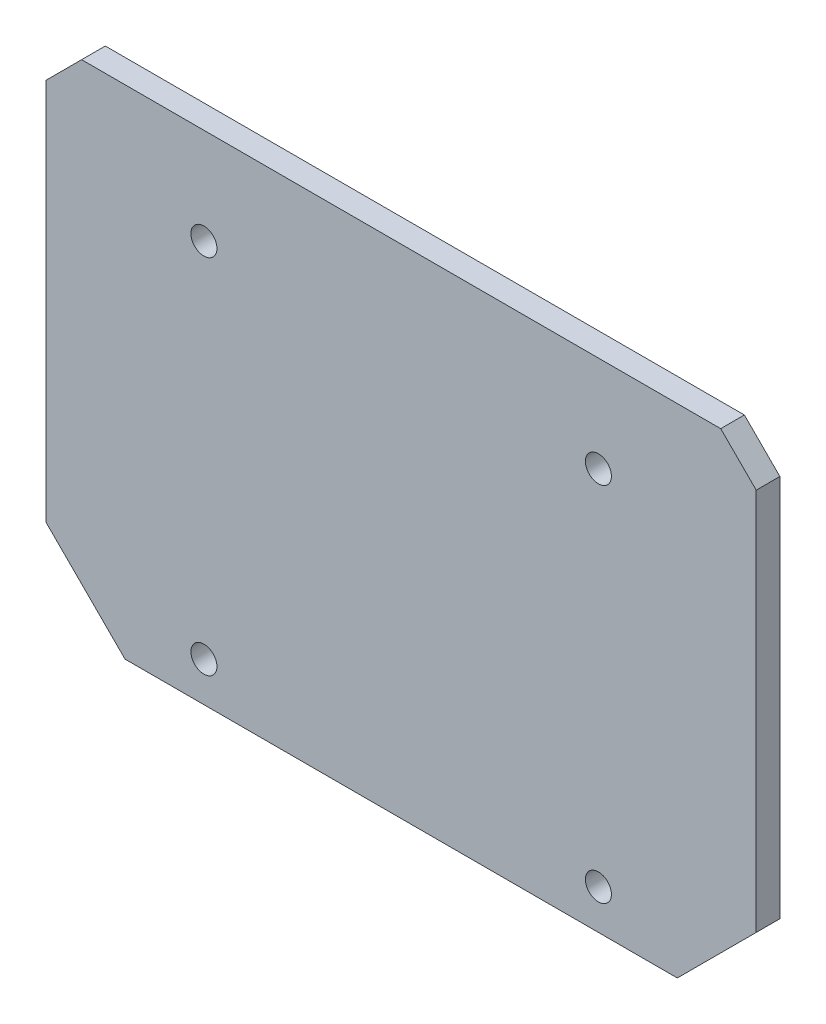
from build123d import *

# Parameters (mm, degrees)
SKETCH1_R           = 1.65
SKETCH1_W           = 3
SKETCH1_H           = 20
SKETCH1_W_2         = 24
SKETCH1_H_2         = 22.230872535
BOSS_EXTRUDE2_DEPTH = 3
SKETCH3_W           = 102.87568526
SKETCH3_H           = 126.113289936
CUT_EXTRUDE1_DEPTH  = 10


with BuildPart() as part:
    # Sketch1 → Boss-Extrude2 (new body)
    with BuildSketch(Plane.XY):
        Polygon((-59.447183423, 47.780041818), (-49.447183423, 57.780041818), (20.552816577, 57.780041818), (30.552816577, 47.780041818), (30.552816577, -0.7691812), (26.052816577, -5.2691812), (25.552816577, -5.2691812), (25.552816577, -50.590735163), (26.052816577, -50.590735163), (30.552816577, -55.090735163), (30.552816577, -103.639958182), (20.552816577, -113.639958182), (-49.447183423, -113.639958182), (-59.447183423, -103.639958182), (-59.447183423, -55.090735163), (-54.947183423, -50.590735163), (-54.447183423, -50.590735163), (-54.447183423, -5.2691812), (-54.947183423, -5.2691812), (-59.447183423, -0.7691812), align=None)
        with Locations((-39.447183423, 52.780041818)):
            Circle(SKETCH1_R, mode=Mode.SUBTRACT)
        with Locations((10.552816577, 52.780041818)):
            Circle(SKETCH1_R, mode=Mode.SUBTRACT)
        with Locations(Location((10.552816577, -108.639958182, 0), (0, 0, 180))):
            Circle(SKETCH1_R, mode=Mode.SUBTRACT)
        with Locations(Location((-39.447183423, -108.639958182, 0), (0, 0, 180))):
            Circle(SKETCH1_R, mode=Mode.SUBTRACT)
        with Locations((10.552816577, -62.748057161)):
            Circle(SKETCH1_R, mode=Mode.SUBTRACT)
        with Locations(Location((-39.447183423, -62.748057161, 0), (0, 0, 180))):
            Circle(SKETCH1_R, mode=Mode.SUBTRACT)
        with Locations((-27.947183423, 11.175041818)):
            Rectangle(SKETCH1_W, SKETCH1_H, mode=Mode.SUBTRACT)
        with Locations((-0.947183423, 11.175041818)):
            Rectangle(SKETCH1_W, SKETCH1_H, mode=Mode.SUBTRACT)
        with Locations((-14.447183423, -27.929958181)):
            Rectangle(SKETCH1_W_2, SKETCH1_H_2, mode=Mode.SUBTRACT)
    extrude(amount=BOSS_EXTRUDE2_DEPTH)

    # Sketch3 → Cut-Extrude1 (cut)
    with BuildSketch(Plane.XY.offset(3)):
        with Locations((-8.901321225, 12.465909805)):
            Rectangle(SKETCH3_W, SKETCH3_H)
    extrude(amount=-CUT_EXTRUDE1_DEPTH, mode=Mode.SUBTRACT)


solid = part.part
